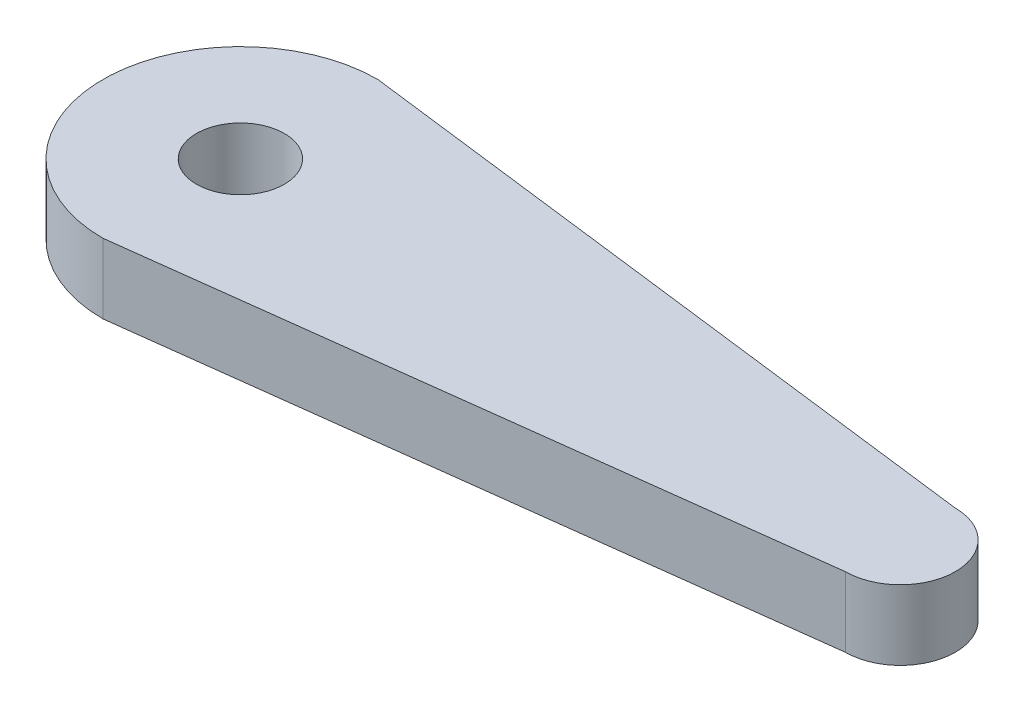
from build123d import *

# Parameters (mm, degrees)
SKETCH1_R           = 4
BOSS_EXTRUDE1_DEPTH = 6.35


with BuildPart() as part:
    # Sketch1 → Boss-Extrude1 (new body)
    with BuildSketch(Plane(origin=(0, 0, 0), x_dir=(1, 0, 0), z_dir=(0, 1, 0))):
        with BuildLine():
            Line((3.076923077, 12.115384615), (0, 12.5))
            ThreePointArc((0, 12.5), (-12.5, 0), (0, -12.5))
            Line((0, -12.5), (3.076923077, -12.115384615))
            Line((3.076923077, -12.115384615), (60, -5))
            ThreePointArc((60, -5), (65, 0), (60, 5))
            Line((60, 5), (3.076923077, 12.115384615))
        make_face()
        with Locations(Location((0, 0, 0), (0, 0, 270))):
            Circle(SKETCH1_R, mode=Mode.SUBTRACT)
    extrude(amount=BOSS_EXTRUDE1_DEPTH)


solid = part.part
